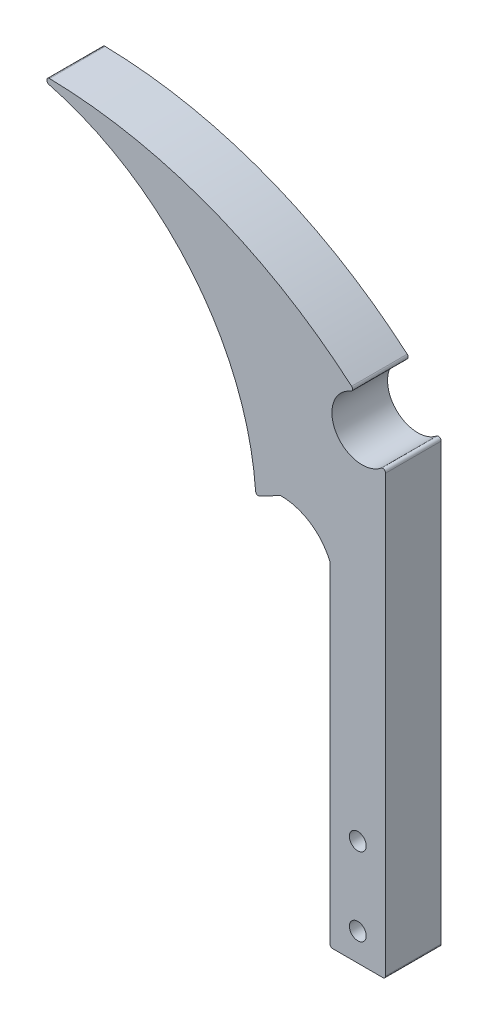
from build123d import *

# Parameters (mm, degrees)
BOSS_EXTRUDE1_DEPTH = 10
FILLET1_R           = 0.5
SKETCH2_R           = 1.515
CUT_EXTRUDE1_DEPTH  = 127.166955858
FILLET2_R           = 0.5


with BuildPart() as part:
    # Sketch1 → Boss-Extrude1 (new body)
    with BuildSketch(Plane.XY):
        with BuildLine():
            Line((0, 0), (0, 80))
            ThreePointArc((0, 80), (-8.82808737, 80.510568582), (-5.446921008, 88.681463327))
            ThreePointArc((-5.446921008, 88.681463327), (-33.19088971, 105.018694036), (-65, 110))
            ThreePointArc((-65, 110), (-36.020401707, 94.064120743), (-23.327746863, 63.524541867))
            Line((-23.327746863, 63.524541867), (-18.907194485, 65.860931532))
            ThreePointArc((-18.907194485, 65.860931532), (-13.559533082, 64.289226454), (-10, 60))
            Line((-10, 60), (-10, 0))
            Line((-10, 0), (0, 0))
        make_face()
    extrude(amount=BOSS_EXTRUDE1_DEPTH)

    # Fillet1
    fillet1_edges = [part.edges().sort_by_distance(p)[0] for p in [
        (-10, 60, 5),
        (-23.327746863, 63.524541867, 5),
        (-65, 110, 5),
        (-5.446921008, 88.681463327, 5),
        (0, 80, 5),
    ]]
    fillet(fillet1_edges, radius=FILLET1_R)

    # Sketch2 → Cut-Extrude1 (cut, through all)
    with BuildSketch(Plane.XY.offset(10)):
        with Locations((-5, 5)):
            Circle(SKETCH2_R)
        with Locations((-5, 19)):
            Circle(SKETCH2_R)
    extrude(amount=-CUT_EXTRUDE1_DEPTH, mode=Mode.SUBTRACT)

    # Fillet2
    fillet2_edges = [part.edges().sort_by_distance(p)[0] for p in [
        (-10, 0, 5),
        (0, 0, 5),
    ]]
    fillet(fillet2_edges, radius=FILLET2_R)


solid = part.part
